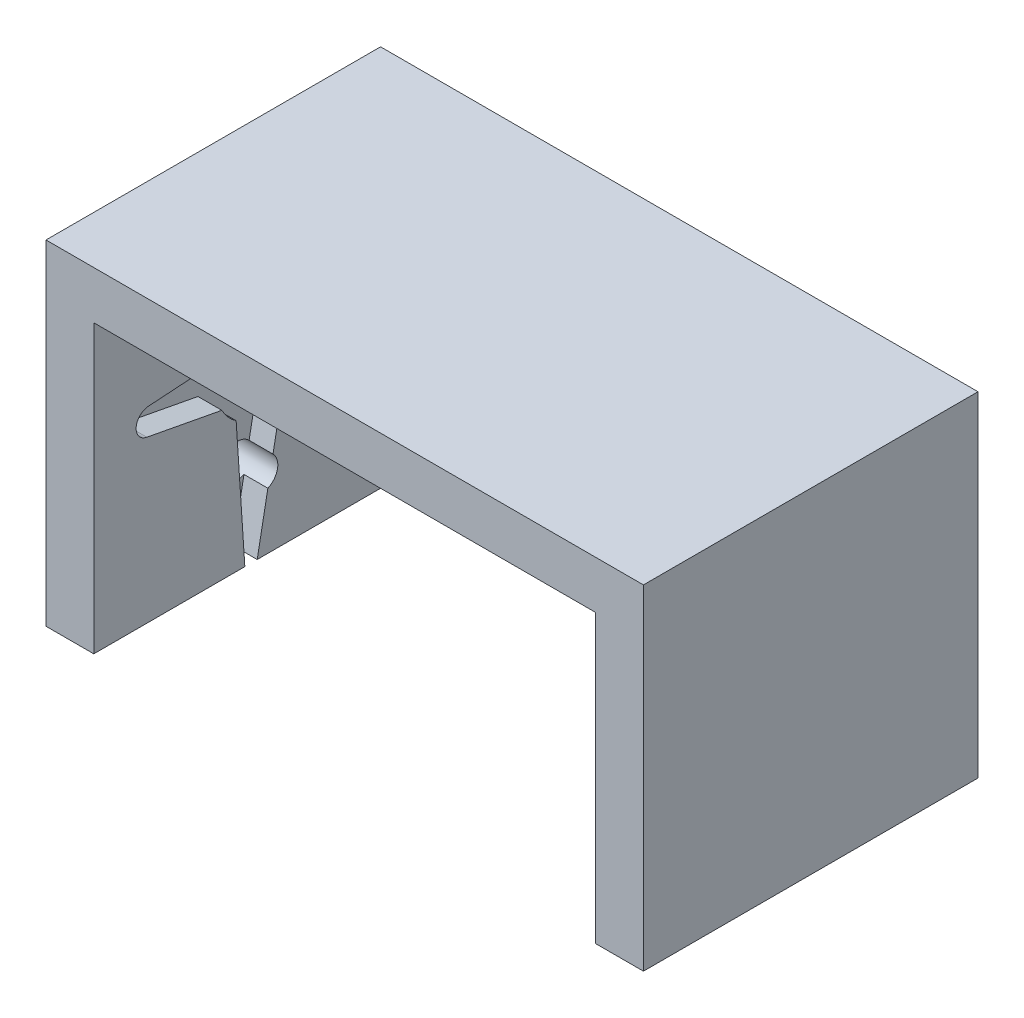
from build123d import *

# Parameters (mm, degrees)
SKETCH2_W           = 125
SKETCH2_H           = 70
BOSS_EXTRUDE1_DEPTH = 10
SKETCH3_W           = 10
SKETCH3_H           = 70
BOSS_EXTRUDE2_DEPTH = 60
CUT_EXTRUDE1_DEPTH  = 5
CUT_EXTRUDE2_START  = -15
SKETCH6_R           = 3.5
CUT_EXTRUDE2_DEPTH  = 15


with BuildPart() as part:
    # Sketch2 → Boss-Extrude1 (new body)
    with BuildSketch(Plane(origin=(0, 0, 0), x_dir=(1, 0, 0), z_dir=(0, 1, 0))):
        Rectangle(SKETCH2_W, SKETCH2_H)
    extrude(amount=BOSS_EXTRUDE1_DEPTH)

    # Sketch3 → Boss-Extrude2 (add)
    with BuildSketch(Plane.XZ):
        with Locations((-57.5, 0)):
            Rectangle(SKETCH3_W, SKETCH3_H)
        with Locations((57.5, 0)):
            Rectangle(SKETCH3_W, SKETCH3_H)
    extrude(amount=BOSS_EXTRUDE2_DEPTH)

    # Sketch4 → Cut-Extrude1 (cut)
    with BuildSketch(Plane(origin=(-52.5, 0, 0), x_dir=(0, 0, -1), z_dir=(1, 0, 0))):
        with BuildLine():
            Line((-3.395932152, -60), (-0.813446687, -60))
            Line((-0.813446687, -60), (1.422755234, -48.197775406))
            ThreePointArc((1.422755234, -48.197775406), (-3.43881752, -44.348437214), (2.493929957, -42.544330362))
            Line((2.493929957, -42.544330362), (4.2626708, -33.209271445))
            ThreePointArc((4.2626708, -33.209271445), (6.134370688, -31.923293743), (7.636341499, -30.220037214))
            Line((7.636341499, -30.220037214), (23.57750665, -29.157373753))
            ThreePointArc((23.57750665, -29.157373753), (26.139587656, -26.579311787), (23.90653542, -23.711535594))
            Line((23.90653542, -23.711535594), (8.209271445, -20.7373292))
            ThreePointArc((8.209271445, -20.7373292), (6.923293743, -18.865629312), (5.220037214, -17.363658501))
            Line((5.220037214, -17.363658501), (4.062548081, 0))
            Line((4.062548081, 0), (-1.081282483, 0))
            Line((-1.081282483, 0), (-4.2626708, -16.790728555))
            ThreePointArc((-4.2626708, -16.790728555), (-6.134370688, -18.076706257), (-7.636341499, -19.779962786))
            Line((-7.636341499, -19.779962786), (-23.57750665, -20.842626247))
            ThreePointArc((-23.57750665, -20.842626247), (-26.139587656, -23.420688213), (-23.90653542, -26.288464406))
            Line((-23.90653542, -26.288464406), (-8.209271445, -29.2626708))
            ThreePointArc((-8.209271445, -29.2626708), (-6.923293743, -31.134370688), (-5.220037214, -32.636341499))
            Line((-5.220037214, -32.636341499), (-3.395932152, -60))
        make_face()
    extrude(amount=-CUT_EXTRUDE1_DEPTH, mode=Mode.SUBTRACT)

    # Sketch6 → Cut-Extrude2 (cut)
    with BuildSketch(Plane.ZY.offset(62.5).offset(CUT_EXTRUDE2_START)):
        with Locations((0, -45)):
            Circle(SKETCH6_R)
    extrude(amount=CUT_EXTRUDE2_DEPTH, mode=Mode.SUBTRACT)


solid = part.part
